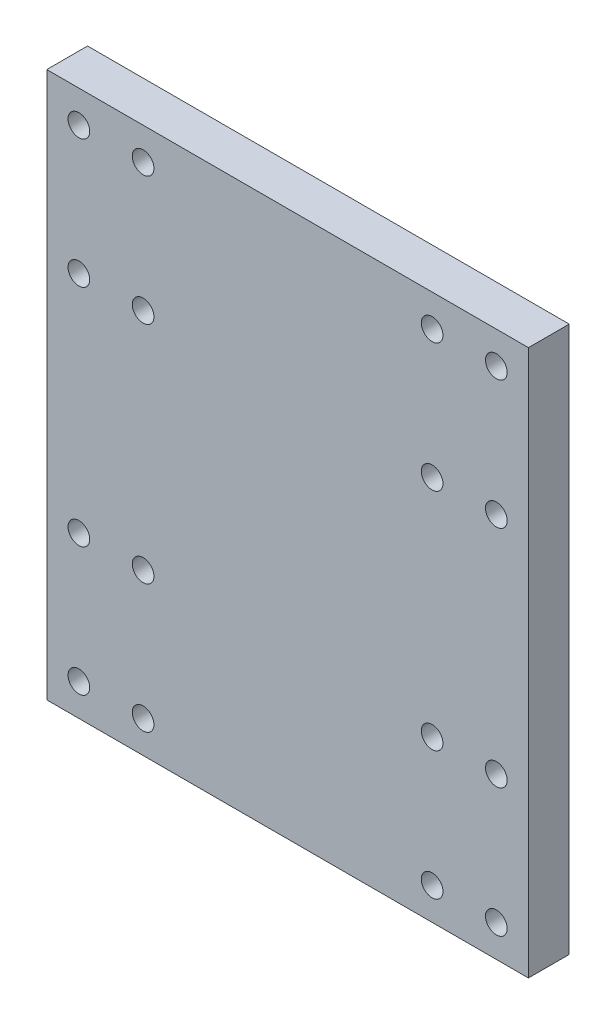
from build123d import *

# Parameters (mm, degrees)
CROQUIS1_W                    = 150
CROQUIS1_H                    = 170
SALIENTE_EXTRUIR1_DEPTH       = 6.35
TALADRO_DE_MARGEN_PARA_1_41_D = 6.7564


with BuildPart() as part:
    # Croquis1 → Saliente-Extruir1 (new, symmetric)
    with BuildSketch(Plane.XY):
        Rectangle(CROQUIS1_W, CROQUIS1_H)
    extrude(amount=SALIENTE_EXTRUIR1_DEPTH, both=True)

    # Taladro de margen para 1/41 (through all)
    with Locations(Plane.XY.offset(6.35)):
        with Locations((65, 75), (65, 35), (45, 35), (45, 75), (45, -75), (45, -35), (65, -35), (65, -75), (-65, -75), (-65, -35), (-45, -35), (-45, -75), (-45, 75), (-45, 35), (-65, 35), (-65, 75)):
            Hole(TALADRO_DE_MARGEN_PARA_1_41_D / 2)


solid = part.part
